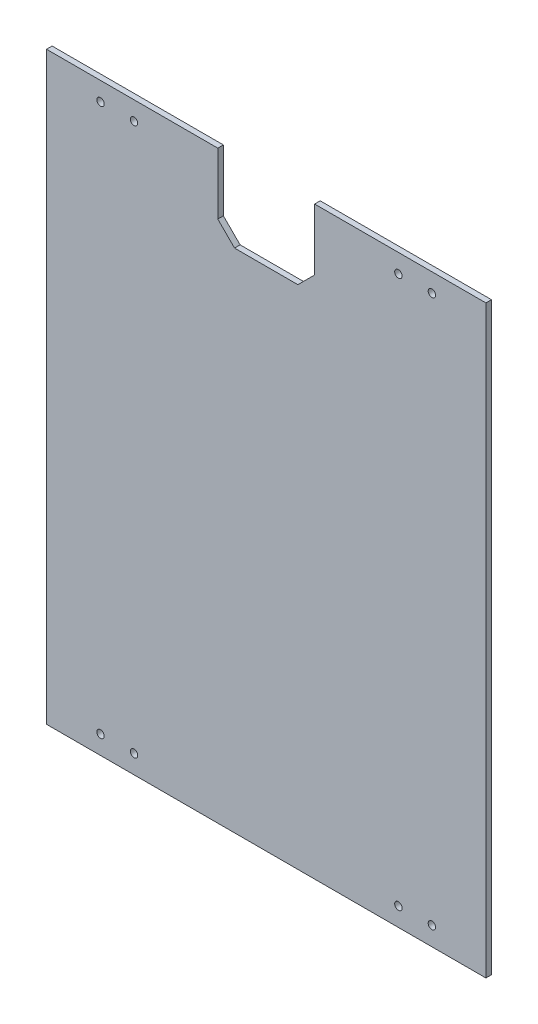
from build123d import *

# Parameters (mm, degrees)
ESQUISSE1_W             = 236
ESQUISSE1_H             = 314
BOSS_EXTRU_1_DEPTH      = 3
ENL_V_MAT_EXTRU_1_REACH = 200.829
ESQUISSE3_R             = 2
ENL_V_MAT_EXTRU_2_REACH = 200.829


with BuildPart() as part:
    # Esquisse1 → Boss.-Extru.1 (new body)
    with BuildSketch(Plane.XY):
        with Locations((0, -3)):
            Rectangle(ESQUISSE1_W, ESQUISSE1_H)
    extrude(amount=BOSS_EXTRU_1_DEPTH)

    # Esquisse3 → Enlèv. mat.-Extru.1 (cut, up to next)
    with BuildSketch(Plane.XY.offset(3), mode=Mode.PRIVATE) as enl_v_mat_extru_1_sk1:
        with Locations((-71, -150)):
            Circle(ESQUISSE3_R)
    enl_v_mat_extru_1_tool1 = extrude(enl_v_mat_extru_1_sk1.sketch, amount=-ENL_V_MAT_EXTRU_1_REACH, mode=Mode.PRIVATE) & part.part
    # Esquisse3 → Enlèv. mat.-Extru.1 (cut, up to next)
    with BuildSketch(Plane.XY.offset(3), mode=Mode.PRIVATE) as enl_v_mat_extru_1_sk2:
        with Locations((-89, -150)):
            Circle(ESQUISSE3_R)
    enl_v_mat_extru_1_tool2 = extrude(enl_v_mat_extru_1_sk2.sketch, amount=-ENL_V_MAT_EXTRU_1_REACH, mode=Mode.PRIVATE) & part.part
    # Esquisse3 → Enlèv. mat.-Extru.1 (cut, up to next)
    with BuildSketch(Plane.XY.offset(3), mode=Mode.PRIVATE) as enl_v_mat_extru_1_sk3:
        with Locations((-89, 144)):
            Circle(ESQUISSE3_R)
    enl_v_mat_extru_1_tool3 = extrude(enl_v_mat_extru_1_sk3.sketch, amount=-ENL_V_MAT_EXTRU_1_REACH, mode=Mode.PRIVATE) & part.part
    # Esquisse3 → Enlèv. mat.-Extru.1 (cut, up to next)
    with BuildSketch(Plane.XY.offset(3), mode=Mode.PRIVATE) as enl_v_mat_extru_1_sk4:
        with Locations((-71, 144)):
            Circle(ESQUISSE3_R)
    enl_v_mat_extru_1_tool4 = extrude(enl_v_mat_extru_1_sk4.sketch, amount=-ENL_V_MAT_EXTRU_1_REACH, mode=Mode.PRIVATE) & part.part
    # Esquisse3 → Enlèv. mat.-Extru.1 (cut, up to next)
    with BuildSketch(Plane.XY.offset(3), mode=Mode.PRIVATE) as enl_v_mat_extru_1_sk5:
        with Locations((71, 144)):
            Circle(ESQUISSE3_R)
    enl_v_mat_extru_1_tool5 = extrude(enl_v_mat_extru_1_sk5.sketch, amount=-ENL_V_MAT_EXTRU_1_REACH, mode=Mode.PRIVATE) & part.part
    # Esquisse3 → Enlèv. mat.-Extru.1 (cut, up to next)
    with BuildSketch(Plane.XY.offset(3), mode=Mode.PRIVATE) as enl_v_mat_extru_1_sk6:
        with Locations((89, 144)):
            Circle(ESQUISSE3_R)
    enl_v_mat_extru_1_tool6 = extrude(enl_v_mat_extru_1_sk6.sketch, amount=-ENL_V_MAT_EXTRU_1_REACH, mode=Mode.PRIVATE) & part.part
    enl_v_mat_extru_1_1 = enl_v_mat_extru_1_tool1.solids().sort_by_distance((-71, -150, 3))[0]
    add(enl_v_mat_extru_1_1, mode=Mode.SUBTRACT)
    enl_v_mat_extru_1_2 = enl_v_mat_extru_1_tool2.solids().sort_by_distance((-89, -150, 3))[0]
    add(enl_v_mat_extru_1_2, mode=Mode.SUBTRACT)
    enl_v_mat_extru_1_3 = enl_v_mat_extru_1_tool3.solids().sort_by_distance((-89, 144, 3))[0]
    add(enl_v_mat_extru_1_3, mode=Mode.SUBTRACT)
    enl_v_mat_extru_1_4 = enl_v_mat_extru_1_tool4.solids().sort_by_distance((-71, 144, 3))[0]
    add(enl_v_mat_extru_1_4, mode=Mode.SUBTRACT)
    enl_v_mat_extru_1_5 = enl_v_mat_extru_1_tool5.solids().sort_by_distance((71, 144, 3))[0]
    add(enl_v_mat_extru_1_5, mode=Mode.SUBTRACT)
    enl_v_mat_extru_1_6 = enl_v_mat_extru_1_tool6.solids().sort_by_distance((89, 144, 3))[0]
    add(enl_v_mat_extru_1_6, mode=Mode.SUBTRACT)
    enl_v_mat_extru_1 = enl_v_mat_extru_1_1 + enl_v_mat_extru_1_2 + enl_v_mat_extru_1_3 + enl_v_mat_extru_1_4 + enl_v_mat_extru_1_5 + enl_v_mat_extru_1_6  # Enlèv. mat.-Extru.1 as one shape, for the pattern or mirror that repeats it

    # Symétrie1: Enlèv. mat.-Extru.1 across plane
    add(enl_v_mat_extru_1.mirror(Plane(origin=(0, 0, 0), x_dir=(0, 0, 1), z_dir=(1, 0, 0))), mode=Mode.SUBTRACT)

    # Esquisse5 → Enlèv. mat.-Extru.2 (cut, up to next)
    with BuildSketch(Plane.XY.offset(3), mode=Mode.PRIVATE) as enl_v_mat_extru_2_sk1:
        Polygon((0, 154), (26, 154), (26, 121), (17, 112), (-17, 112), (-26, 121), (-26, 154), align=None)
    enl_v_mat_extru_2_tool1 = extrude(enl_v_mat_extru_2_sk1.sketch, amount=-ENL_V_MAT_EXTRU_2_REACH, mode=Mode.PRIVATE) & part.part
    add(enl_v_mat_extru_2_tool1.solids().sort_by_distance((0, 133.693295, 3))[0], mode=Mode.SUBTRACT)


solid = part.part
